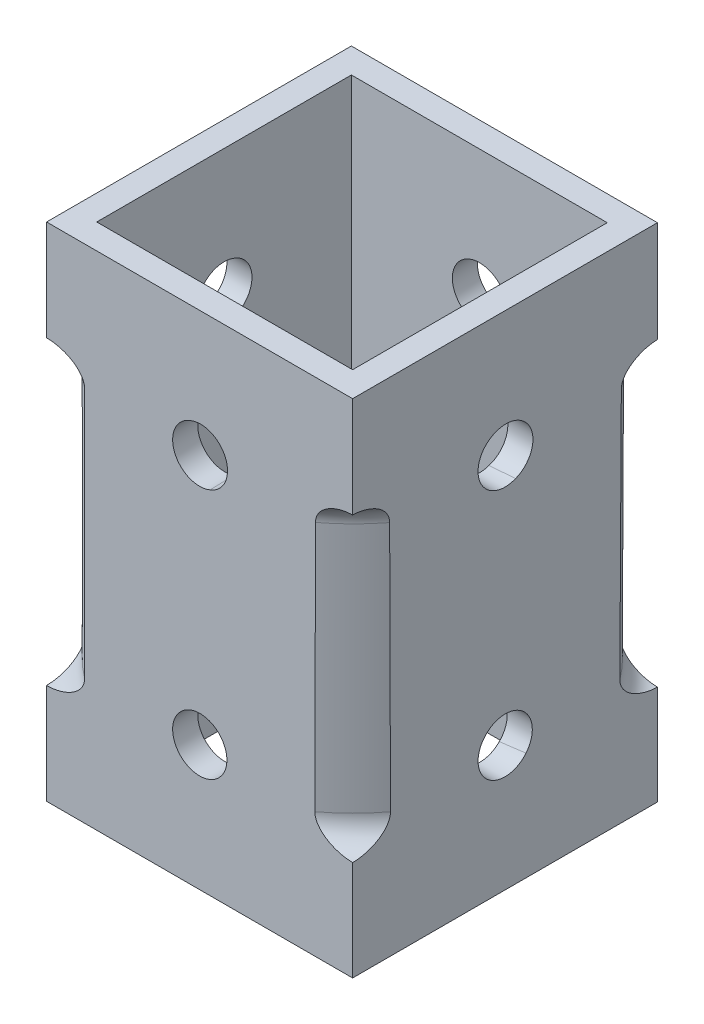
from build123d import *

# Parameters (mm, degrees)
SKETCH1_W           = 24.4
SKETCH1_H           = 24.3
SKETCH1_W_2         = 20.4
SKETCH1_H_2         = 20.3
BOSS_EXTRUDE1_DEPTH = 40
SKETCH3_R           = 2.15
CUT_EXTRUDE1_DEPTH  = 40
CIRPATTERN1_COUNT   = 4


with BuildPart() as part:
    # Sketch1 → Boss-Extrude1 (new body)
    with BuildSketch(Plane(origin=(0, 0, 0), x_dir=(1, 0, 0), z_dir=(0, 1, 0))):
        Rectangle(SKETCH1_W, SKETCH1_H)
        Rectangle(SKETCH1_W_2, SKETCH1_H_2, mode=Mode.SUBTRACT)
    extrude(amount=BOSS_EXTRUDE1_DEPTH)

    # Sketch2 → Cut-Revolve1 (revolve, cut)
    with BuildSketch(Plane(origin=(0, 0, 0), x_dir=(0.7085572520498782, 0, -0.7056533288857395), z_dir=(0.7056533288857395, 0, 0.7085572520498782))):
        with BuildLine():
            Line((-19.218086421, 10), (-19.218086421, 30))
            ThreePointArc((-19.218086421, 30), (-17.218086421, 32), (-15.218086421, 30))
            Line((-15.218086421, 30), (-15.218086421, 10))
            ThreePointArc((-15.218086421, 10), (-17.218086421, 8), (-19.218086421, 10))
        make_face()
    revolve(axis=Axis((0.050102458, 40, -0.04989712), (-0.0012525594966950285, -0.9999984375102502, 0.0012474260561348032)), mode=Mode.SUBTRACT)

    # Sketch3 → Cut-Extrude1 (cut, symmetric)
    with BuildSketch(Plane.XY.offset(-10.15)):
        with Locations((0, 30)):
            Circle(SKETCH3_R)
        with Locations((0, 10)):
            Circle(SKETCH3_R)
    cut_extrude1 = extrude(amount=CUT_EXTRUDE1_DEPTH, both=True, mode=Mode.SUBTRACT)

    # CirPattern1: Cut-Extrude1 ×4 about axis
    cirpattern1_axis = Axis((0.050102458, 40, -0.04989712), (-0.0012525594966950285, -0.9999984375102502, 0.0012474260561348032))
    for i in range(1, CIRPATTERN1_COUNT):
        add(cut_extrude1.rotate(cirpattern1_axis, i * 360 / CIRPATTERN1_COUNT), mode=Mode.SUBTRACT)


solid = part.part
